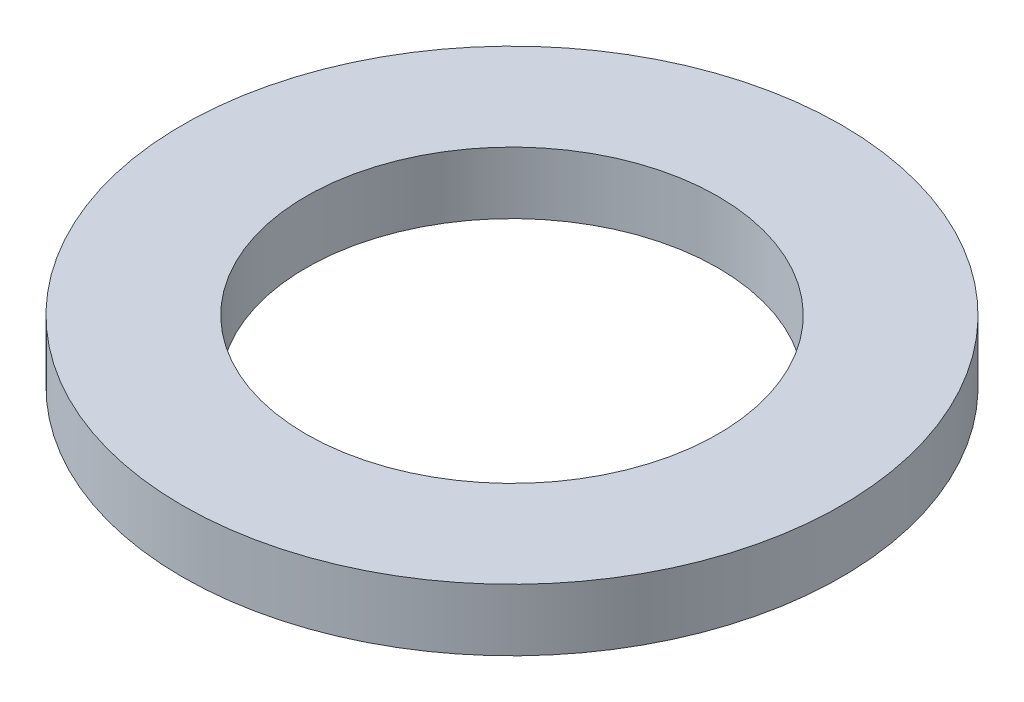
from build123d import *

# Parameters (mm, degrees)
SKETCH1_R           = 12.7
SKETCH1_R_2         = 7.9375
BOSS_EXTRUDE1_DEPTH = 2.3876


with BuildPart() as part:
    # Sketch1 → Boss-Extrude1 (new body)
    with BuildSketch(Plane(origin=(0, 0, 0), x_dir=(1, 0, 0), z_dir=(0, 1, 0))):
        with Locations(Location((0, 0, 0), (0, 0, 270))):
            Circle(SKETCH1_R)
        with Locations(Location((0, 0, 0), (0, 0, 270))):
            Circle(SKETCH1_R_2, mode=Mode.SUBTRACT)
    extrude(amount=BOSS_EXTRUDE1_DEPTH)


solid = part.part
